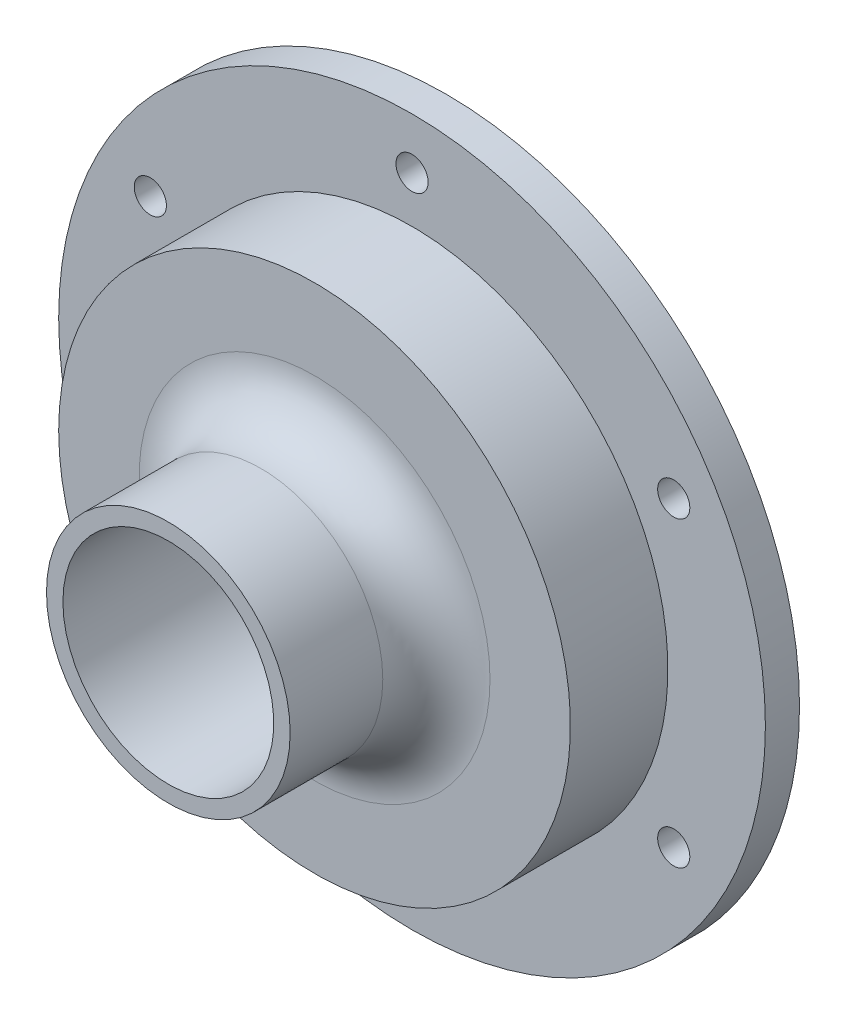
from build123d import *

# Parameters (mm, degrees)
FILLET1_R                               = 11
CBORE_FOR_M6_HEX_HEAD_BOLT1_D           = 6.6
CBORE_FOR_M6_HEX_HEAD_BOLT1_CBORE_D     = 14.547
CBORE_FOR_M6_HEX_HEAD_BOLT1_CBORE_DEPTH = 1
CIRPATTERN1_COUNT                       = 6


with BuildPart() as part:
    # Sketch1 → Revolve1 (revolve)
    with BuildSketch(Plane(origin=(0, 0, 0), x_dir=(1, 0, 0), z_dir=(0, 1, 0))):
        Polygon((-21.63, 0), (-72.5, 0), (-72.5, -7), (-52.5, -7), (-52.5, -27), (-25, -27), (-25, -57), (-21.63, -57), align=None)
    revolve(axis=Axis((0, 0, 0), (0, 0, 1)))

    # Fillet1
    fillet1_edges = [part.edges().sort_by_distance(p)[0] for p in [
        (25, 0, 27),
    ]]
    fillet(fillet1_edges, radius=FILLET1_R)

    # CBORE for M6 Hex Head Bolt1 (through all)
    with Locations(Plane(origin=(0, 0, 0), x_dir=(-1, 0, 0), z_dir=(0, 0, -1))):
        with Locations((0, 62)):
            cbore_for_m6_hex_head_bolt1 = CounterBoreHole(CBORE_FOR_M6_HEX_HEAD_BOLT1_D / 2, CBORE_FOR_M6_HEX_HEAD_BOLT1_CBORE_D / 2, CBORE_FOR_M6_HEX_HEAD_BOLT1_CBORE_DEPTH)

    # CirPattern1: CBORE for M6 Hex Head Bolt1 ×6 about axis
    cirpattern1_axis = Axis((0, 0, 0), (0, 0, 1))
    for i in range(1, CIRPATTERN1_COUNT):
        add(cbore_for_m6_hex_head_bolt1.rotate(cirpattern1_axis, i * 360 / CIRPATTERN1_COUNT), mode=Mode.SUBTRACT)


solid = part.part
